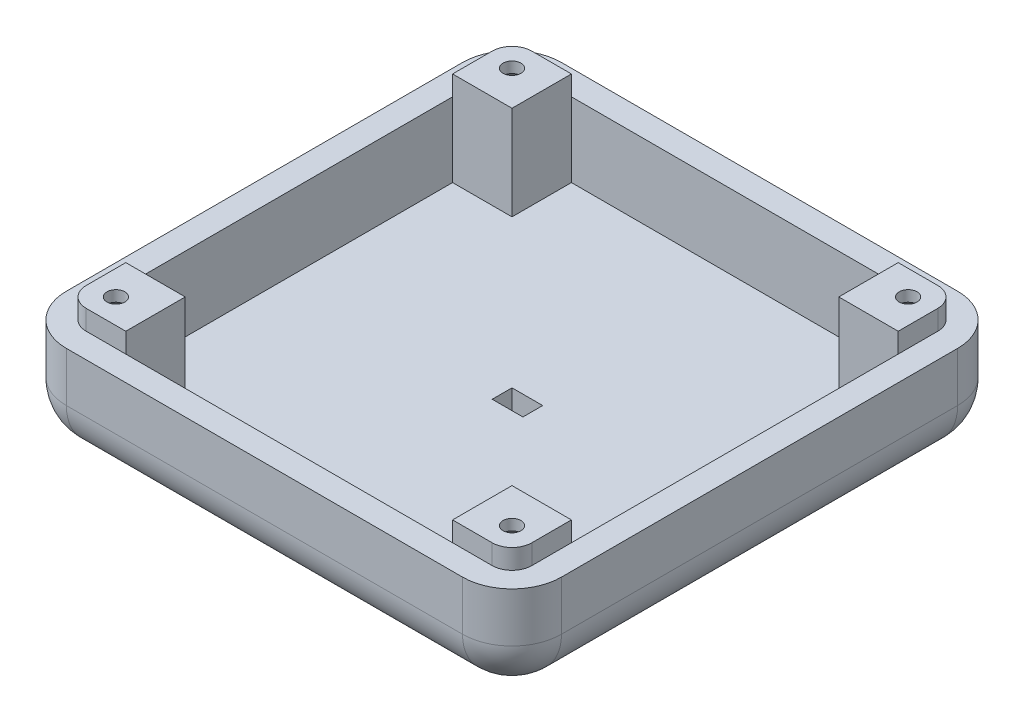
from build123d import *

# Parameters (mm, degrees)
SKETCH1_W                                    = 50
SKETCH1_H                                    = 50
BOSS_EXTRUDE1_DEPTH                          = 10
SHELL1_T                                     = -2.5
FILLET1_R                                    = 5
SKETCH2_W                                    = 6
SKETCH2_H                                    = 6
BOSS_EXTRUDE2_DEPTH                          = 9.5
CSK_SLOT_FOR_M1_6_COUNTERSUNK_FLAT_H_2_COUNT = 2
CSK_SLOT_FOR_M1_6_COUNTERSUNK_FLAT_H_2_PITCH = 40
CSK_SLOT_FOR_M1_6_COUNTERSUNK_FLAT_H_3_COUNT = 2
CSK_SLOT_FOR_M1_6_COUNTERSUNK_FLAT_H_3_PITCH = 56.568542495
CSK_SLOT_FOR_M1_6_COUNTERSUNK_FLAT_H_4_COUNT = 2
CSK_SLOT_FOR_M1_6_COUNTERSUNK_FLAT_H_4_PITCH = 40
SKETCH7_W                                    = 12
SKETCH7_H                                    = 23
BOSS_EXTRUDE3_DEPTH                          = 6
SKETCH8_W                                    = 2
SKETCH8_H                                    = 3
CUT_EXTRUDE1_DEPTH                           = 43.72294479
FILLET2_R                                    = 1
SKETCH9_W                                    = 4.34
SKETCH9_H                                    = 1.8
CUT_EXTRUDE2_DEPTH                           = 4.4
SKETCH10_W                                   = 3.1
SKETCH10_H                                   = 1.1
CUT_EXTRUDE3_DEPTH                           = 3.55
CUT_EXTRUDE4_REACH                           = 40.194
SKETCH13_W                                   = 3.1
SKETCH13_H                                   = 2
FILLET3_R                                    = 2


with BuildPart() as part:
    # Sketch1 → Boss-Extrude1 (new body)
    with BuildSketch(Plane(origin=(0, 0, 0), x_dir=(1, 0, 0), z_dir=(0, 1, 0))):
        Rectangle(SKETCH1_W, SKETCH1_H)
    extrude(amount=BOSS_EXTRUDE1_DEPTH)

    # Shell1
    shell1_openings = [part.faces().sort_by_distance(p)[0] for p in [
        (0, 10, 0),
    ]]
    offset(amount=SHELL1_T, openings=shell1_openings, kind=Kind.INTERSECTION)

    # Fillet1
    fillet1_edges = [part.edges().sort_by_distance(p)[0] for p in [
        (0, 0, 25),
        (-25, 0, 0),
        (0, 0, -25),
        (25, 0, 0),
        (25, 5, 25),
        (-25, 5, 25),
        (-25, 5, -25),
        (25, 5, -25),
    ]]
    fillet(fillet1_edges, radius=FILLET1_R)

    # Sketch2 → Boss-Extrude2 (add)
    with BuildSketch(Plane(origin=(0, 2.5, 0), x_dir=(1, 0, 0), z_dir=(0, 1, 0))):
        with Locations((19.5, 19.5)):
            Rectangle(SKETCH2_W, SKETCH2_H)
        with Locations((-19.5, 19.5)):
            Rectangle(SKETCH2_W, SKETCH2_H)
        with Locations((19.5, -19.5)):
            Rectangle(SKETCH2_W, SKETCH2_H)
        with Locations((-19.5, -19.5)):
            Rectangle(SKETCH2_W, SKETCH2_H)
    extrude(amount=BOSS_EXTRUDE2_DEPTH)

    # Sketch6 → CSK SLOT for M1.6 Countersunk Flat Head Screw1 (revolve, cut)
    with BuildSketch(Plane(origin=(20, 0, 20), x_dir=(0, 0, -1), z_dir=(1, 0, 0))):
        Polygon((0, 0), (0, 12), (0.9, 12), (0.9, 10.9), (1.8, 10), (1.8, 0), align=None)
    csk_slot_for_m1_6_countersunk_flat_head = revolve(axis=Axis((20, -6.35, 20), (0, 1, 0)), mode=Mode.SUBTRACT)

    # CSK SLOT for M1.6 Countersunk Flat H 2: CSK SLOT for M1.6 Countersunk Flat Head Screw1 ×2
    with Locations(*[(-i * CSK_SLOT_FOR_M1_6_COUNTERSUNK_FLAT_H_2_PITCH, 0, 0) for i in range(1, CSK_SLOT_FOR_M1_6_COUNTERSUNK_FLAT_H_2_COUNT)]):
        add(csk_slot_for_m1_6_countersunk_flat_head, mode=Mode.SUBTRACT)

    # CSK SLOT for M1.6 Countersunk Flat H 3: CSK SLOT for M1.6 Countersunk Flat Head Screw1 ×2
    with Locations(*[Vector(-0.7071067811865476, 0, -0.7071067811865475) * (i * CSK_SLOT_FOR_M1_6_COUNTERSUNK_FLAT_H_3_PITCH) for i in range(1, CSK_SLOT_FOR_M1_6_COUNTERSUNK_FLAT_H_3_COUNT)]):
        add(csk_slot_for_m1_6_countersunk_flat_head, mode=Mode.SUBTRACT)

    # CSK SLOT for M1.6 Countersunk Flat H 4: CSK SLOT for M1.6 Countersunk Flat Head Screw1 ×2
    with Locations(*[(0, 0, -i * CSK_SLOT_FOR_M1_6_COUNTERSUNK_FLAT_H_4_PITCH) for i in range(1, CSK_SLOT_FOR_M1_6_COUNTERSUNK_FLAT_H_4_COUNT)]):
        add(csk_slot_for_m1_6_countersunk_flat_head, mode=Mode.SUBTRACT)

    # Sketch7 → Boss-Extrude3 (add)
    with BuildSketch(Plane.XZ):
        with Locations((0, 4)):
            Rectangle(SKETCH7_W, SKETCH7_H)
    extrude(amount=BOSS_EXTRUDE3_DEPTH)

    # Sketch8 → Cut-Extrude1 (cut, through all)
    with BuildSketch(Plane(origin=(0, 0, -7.5), x_dir=(-1, 0, 0), z_dir=(0, 0, -1))):
        with Locations((5, -1.5)):
            Rectangle(SKETCH8_W, SKETCH8_H)
        with Locations((-5, -1.5)):
            Rectangle(SKETCH8_W, SKETCH8_H)
    extrude(amount=-CUT_EXTRUDE1_DEPTH, mode=Mode.SUBTRACT)

    # Fillet2
    fillet2_edges = [part.edges().sort_by_distance(p)[0] for p in [
        (-6, -4.5, -7.5),
        (6, -4.5, -7.5),
        (0, -6, -7.5),
    ]]
    fillet(fillet2_edges, radius=FILLET2_R)

    # Sketch9 → Cut-Extrude2 (cut)
    with BuildSketch(Plane(origin=(0, 0, -7.5), x_dir=(-1, 0, 0), z_dir=(0, 0, -1))):
        with Locations((0, -3)):
            Rectangle(SKETCH9_W, SKETCH9_H)
    extrude(amount=-CUT_EXTRUDE2_DEPTH, mode=Mode.SUBTRACT)

    # Sketch10 → Cut-Extrude3 (cut)
    with BuildSketch(Plane(origin=(0, 0, -3.1), x_dir=(-1, 0, 0), z_dir=(0, 0, -1))):
        with Locations((0, -3)):
            Rectangle(SKETCH10_W, SKETCH10_H)
    extrude(amount=-CUT_EXTRUDE3_DEPTH, mode=Mode.SUBTRACT)

    # Sketch13 → Cut-Extrude4 (cut, up to next)
    with BuildSketch(Plane.XZ.offset(2.45), mode=Mode.PRIVATE) as cut_extrude4_sk1:
        with Locations((0, -0.55)):
            Rectangle(SKETCH13_W, SKETCH13_H)
    cut_extrude4_tool1 = extrude(cut_extrude4_sk1.sketch, amount=-CUT_EXTRUDE4_REACH, mode=Mode.PRIVATE) & part.part
    add(cut_extrude4_tool1.solids().sort_by_distance((0, -2.45, -0.55))[0], mode=Mode.SUBTRACT)

    # Fillet3
    fillet3_edges = [part.edges().sort_by_distance(p)[0] for p in [
        (-22.5, 11, 22.5),
        (-22.5, 11, -22.5),
        (22.5, 11, -22.5),
        (22.5, 11, 22.5),
    ]]
    fillet(fillet3_edges, radius=FILLET3_R)


solid = part.part
